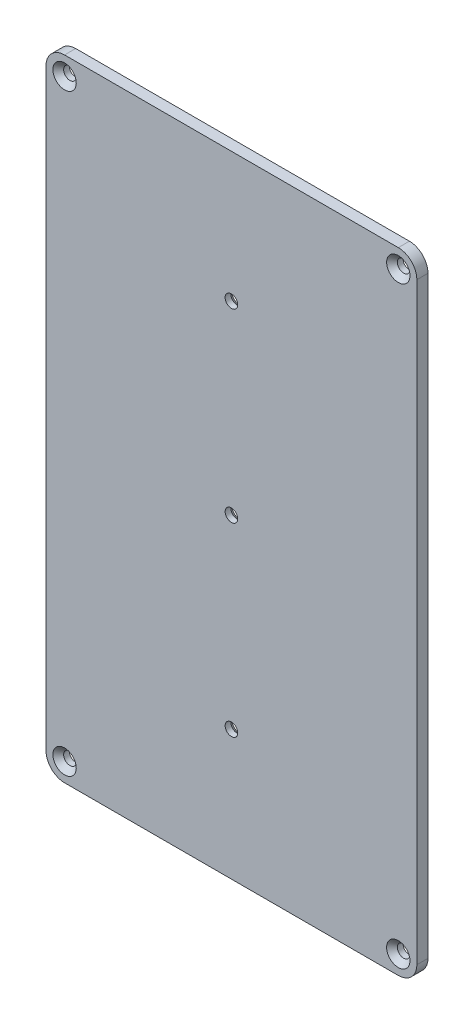
from build123d import *

# Parameters (mm, degrees)
SKETCH1_W                                       = 100
SKETCH1_H                                       = 170
BOSS_EXTRUDE1_DEPTH                             = 3
CSK_FOR_M3_FLAT_HEAD_MACHINE_SCREW1_D           = 3.4
CSK_FOR_M3_FLAT_HEAD_MACHINE_SCREW1_DEPTH       = 7.5
CSK_FOR_M3_FLAT_HEAD_MACHINE_SCREW1_CSINK_D     = 6.3
CSK_FOR_M3_FLAT_HEAD_MACHINE_SCREW1_CSINK_ANGLE = 90
CSK_FOR_M3_FLAT_HEAD_MACHINE_SCREW1_TIP         = 1.021463052
FILLET1_R                                       = 5
CSK_FOR_M3_FLAT_HEAD_MACHINE_SCREW2_D           = 3.4
CSK_FOR_M3_FLAT_HEAD_MACHINE_SCREW2_DEPTH       = 7.5
CSK_FOR_M3_FLAT_HEAD_MACHINE_SCREW2_CSINK_D     = 6.3
CSK_FOR_M3_FLAT_HEAD_MACHINE_SCREW2_CSINK_ANGLE = 90
CSK_FOR_M3_FLAT_HEAD_MACHINE_SCREW2_TIP         = 1.021463052


with BuildPart() as part:
    # Sketch1 → Boss-Extrude1 (new body)
    with BuildSketch(Plane.XY):
        with Locations((50, 85)):
            Rectangle(SKETCH1_W, SKETCH1_H)
    extrude(amount=BOSS_EXTRUDE1_DEPTH)

    # CSK for M3 Flat Head Machine Screw1
    with Locations(Plane.XY.offset(3)):
        with Locations((5, 165), (95, 165), (95, 5), (5, 5)):
            CounterSinkHole(CSK_FOR_M3_FLAT_HEAD_MACHINE_SCREW1_D / 2, CSK_FOR_M3_FLAT_HEAD_MACHINE_SCREW1_CSINK_D / 2, depth=CSK_FOR_M3_FLAT_HEAD_MACHINE_SCREW1_DEPTH, counter_sink_angle=CSK_FOR_M3_FLAT_HEAD_MACHINE_SCREW1_CSINK_ANGLE)
            with Locations((0, 0, -(CSK_FOR_M3_FLAT_HEAD_MACHINE_SCREW1_DEPTH + CSK_FOR_M3_FLAT_HEAD_MACHINE_SCREW1_TIP / 2))):  # 118° drill point
                Cone(0, CSK_FOR_M3_FLAT_HEAD_MACHINE_SCREW1_D / 2, CSK_FOR_M3_FLAT_HEAD_MACHINE_SCREW1_TIP, mode=Mode.SUBTRACT)

    # Fillet1
    fillet1_edges = [part.edges().sort_by_distance(p)[0] for p in [
        (0, 170, 1.5),
        (100, 170, 1.5),
        (100, 0, 1.5),
        (0, 0, 1.5),
    ]]
    fillet(fillet1_edges, radius=FILLET1_R)

    # CSK for M3 Flat Head Machine Screw2
    with Locations(Plane(origin=(0, 0, 0), x_dir=(-1, 0, 0), z_dir=(0, 0, -1))):
        with Locations((-50, 135), (-50, 85), (-50, 35)):
            CounterSinkHole(CSK_FOR_M3_FLAT_HEAD_MACHINE_SCREW2_D / 2, CSK_FOR_M3_FLAT_HEAD_MACHINE_SCREW2_CSINK_D / 2, depth=CSK_FOR_M3_FLAT_HEAD_MACHINE_SCREW2_DEPTH, counter_sink_angle=CSK_FOR_M3_FLAT_HEAD_MACHINE_SCREW2_CSINK_ANGLE)
            with Locations((0, 0, -(CSK_FOR_M3_FLAT_HEAD_MACHINE_SCREW2_DEPTH + CSK_FOR_M3_FLAT_HEAD_MACHINE_SCREW2_TIP / 2))):  # 118° drill point
                Cone(0, CSK_FOR_M3_FLAT_HEAD_MACHINE_SCREW2_D / 2, CSK_FOR_M3_FLAT_HEAD_MACHINE_SCREW2_TIP, mode=Mode.SUBTRACT)


solid = part.part
